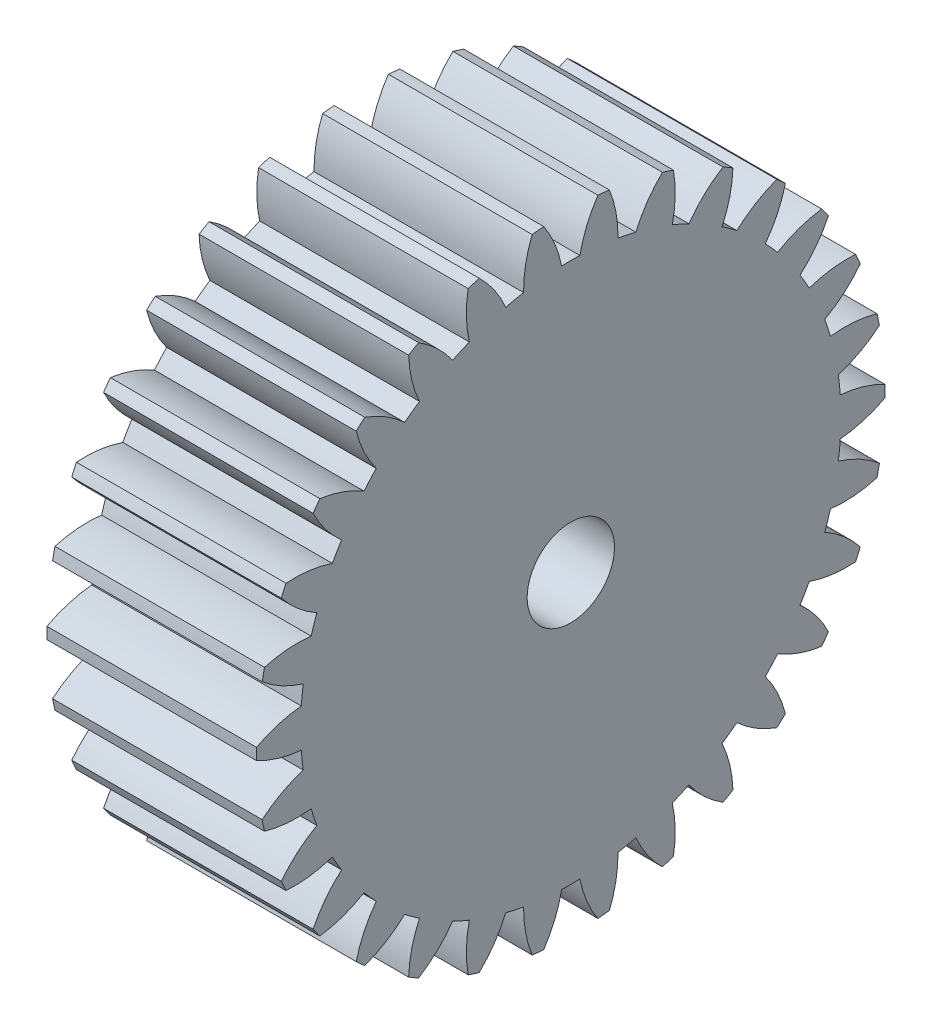
from build123d import *

# Parameters (mm, degrees)
BASPROSKE_W     = 12
BASPROSKE_H     = 18
TOOTHCUT_DEPTH  = 29.142494559
TEETHCUTS_COUNT = 30
TEETHCUTS_ANGLE = 348
BORSKE_R        = 2.5
BORE_DEPTH      = 50.0000508


with BuildPart() as part:
    # BasProSke → Base-Revolve (revolve)
    with BuildSketch(Plane(origin=(0, 0, 0), x_dir=(1, 0, 0), z_dir=(0, 1, 0)), mode=Mode.PRIVATE) as base_revolve_sk:
        with Locations((6, 9)):
            Rectangle(BASPROSKE_W, BASPROSKE_H)
    revolve(base_revolve_sk.sketch.rotate(Axis((-10, 0, 0), (1, 0, 0)), 180), axis=Axis((-10, 0, 0), (1, 0, 0)))

    # TooCutSke → ToothCut (cut, through all)
    with BuildSketch(Plane(origin=(0, 0, 0), x_dir=(0, 0, -1), z_dir=(1, 0, 0))):
        with BuildLine():
            ThreePointArc((0.523521522, 15.458887906), (0, 15.46775), (-0.523521522, 15.458887906))
            ThreePointArc((-0.523521522, 15.458887906), (-0.919551256, 16.760900189), (-1.568701479, 17.957010353))
            ThreePointArc((-1.568701479, 17.957010353), (0, 18.0254), (1.568701479, 17.957010353))
            ThreePointArc((1.568701479, 17.957010353), (0.919551256, 16.760900189), (0.523521522, 15.458887906))
        make_face()
    toothcut = extrude(amount=TOOTHCUT_DEPTH, mode=Mode.SUBTRACT)

    # TeethCuts: ToothCut ×30 about axis
    teethcuts_axis = Axis((-10, 0, 0), (1, 0, 0))
    for i in range(1, TEETHCUTS_COUNT):
        add(toothcut.rotate(teethcuts_axis, i * TEETHCUTS_ANGLE / (TEETHCUTS_COUNT - 1)), mode=Mode.SUBTRACT)

    # BorSke → Bore (cut, symmetric)
    with BuildSketch(Plane(origin=(0, 0, 0), x_dir=(0, 0, -1), z_dir=(1, 0, 0))):
        with Locations(Location((0, 0, 0), (0, 0, 180))):
            Circle(BORSKE_R)
    extrude(amount=BORE_DEPTH, both=True, mode=Mode.SUBTRACT)


solid = part.part
